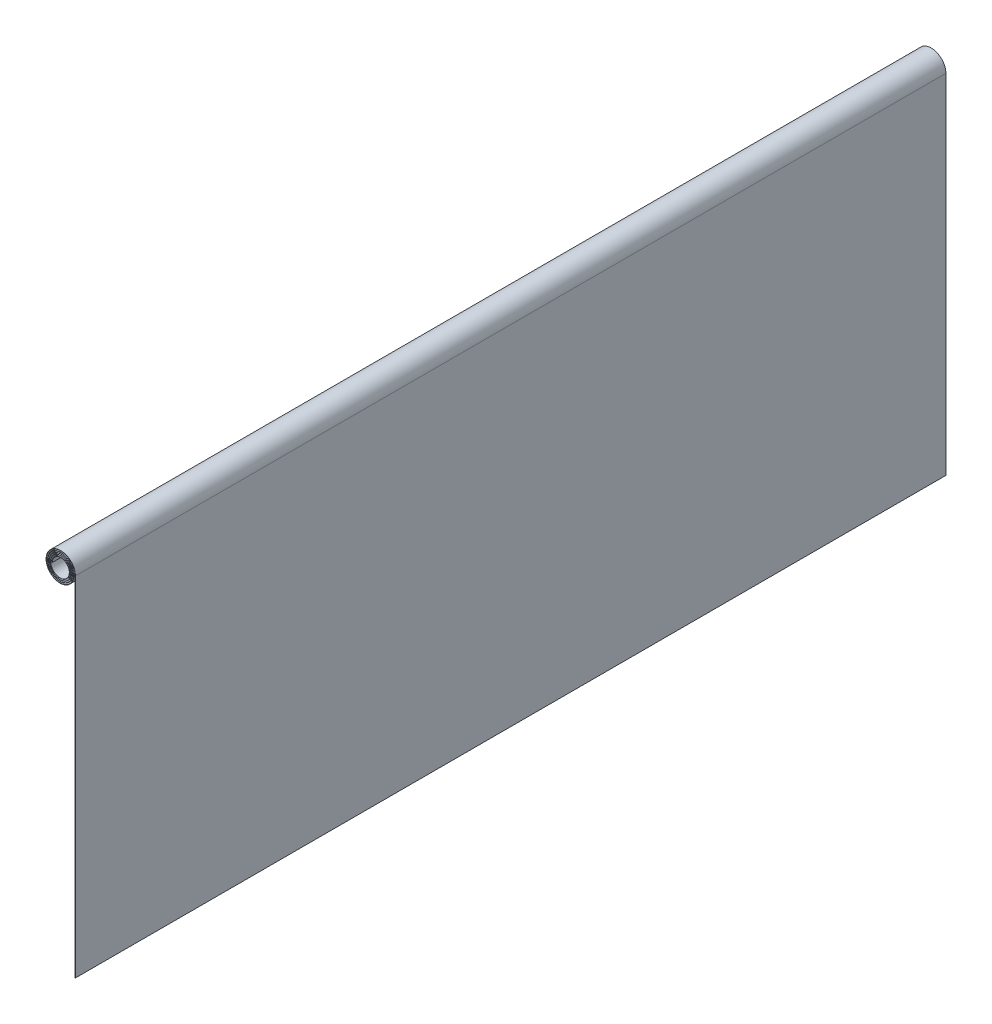
from build123d import *

# Parameters (mm, degrees)
SKETCH_2_W = 0.5
SKETCH_2_H = 1500


with BuildPart() as part:
    # 扫描1: sweep along a path in 草图1
    with BuildLine(Plane.XY) as sweep_1_path:
        Line((25, -600), (25, 0))
        ThreePointArc((25, 0), (0, 25), (-25, 0))
        ThreePointArc((-25, 0), (-1.25, -23.75), (22.5, 0))
        ThreePointArc((22.5, 0), (0, 22.5), (-22.5, 0))
        ThreePointArc((-22.5, 0), (-1.25, -21.25), (20, 0))
        ThreePointArc((20, 0), (0, 20), (-20, 0))
        ThreePointArc((-20, 0), (-1.25, -18.75), (17.5, 0))
        ThreePointArc((17.5, 0), (0, 17.5), (-17.5, 0))
        ThreePointArc((-17.5, 0), (-1.25, -16.25), (15, 0))
        ThreePointArc((15, 0), (0, 15), (-15, 0))
    # 草图2 → 扫描1 (sweep)
    with BuildSketch(Plane(origin=(0, -600, 0), x_dir=(1, 0, 0), z_dir=(0, 1, 0))):
        with Locations((25, 0)):
            Rectangle(SKETCH_2_W, SKETCH_2_H)
    sweep(path=sweep_1_path.line)


solid = part.part
